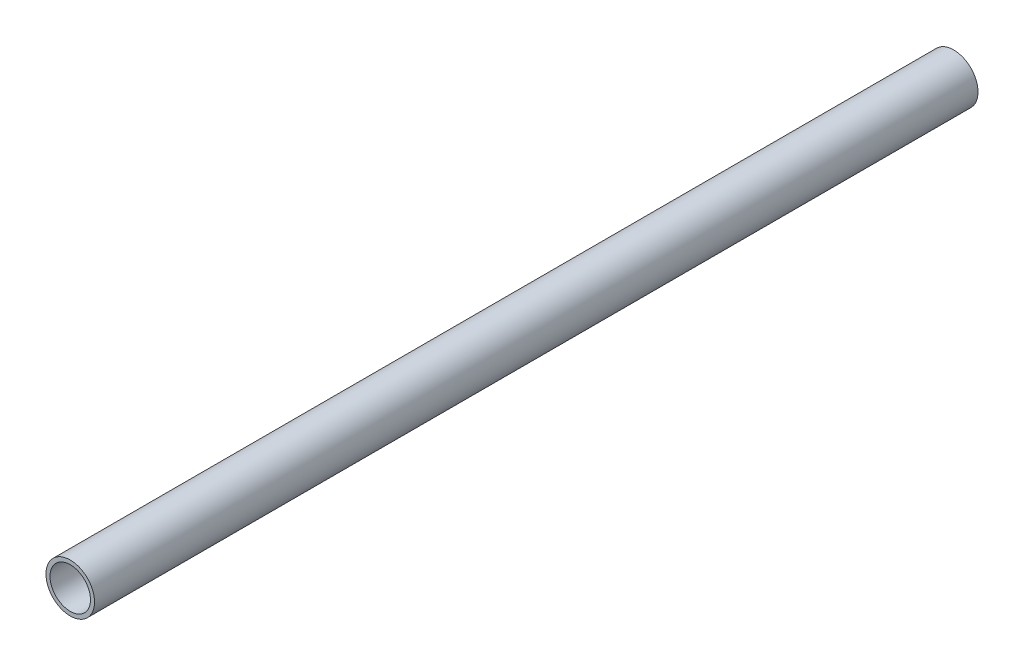
from build123d import *

# Parameters (mm, degrees)
ESQUISSE1_R        = 18
ESQUISSE1_R_2      = 15
EXTRU_MINCE1_DEPTH = 655


with BuildPart() as part:
    # Esquisse1 → Extru.-Mince1 (new body)
    with BuildSketch(Plane.XY):
        Circle(ESQUISSE1_R)
        Circle(ESQUISSE1_R_2, mode=Mode.SUBTRACT)
    extrude(amount=EXTRU_MINCE1_DEPTH)


solid = part.part
